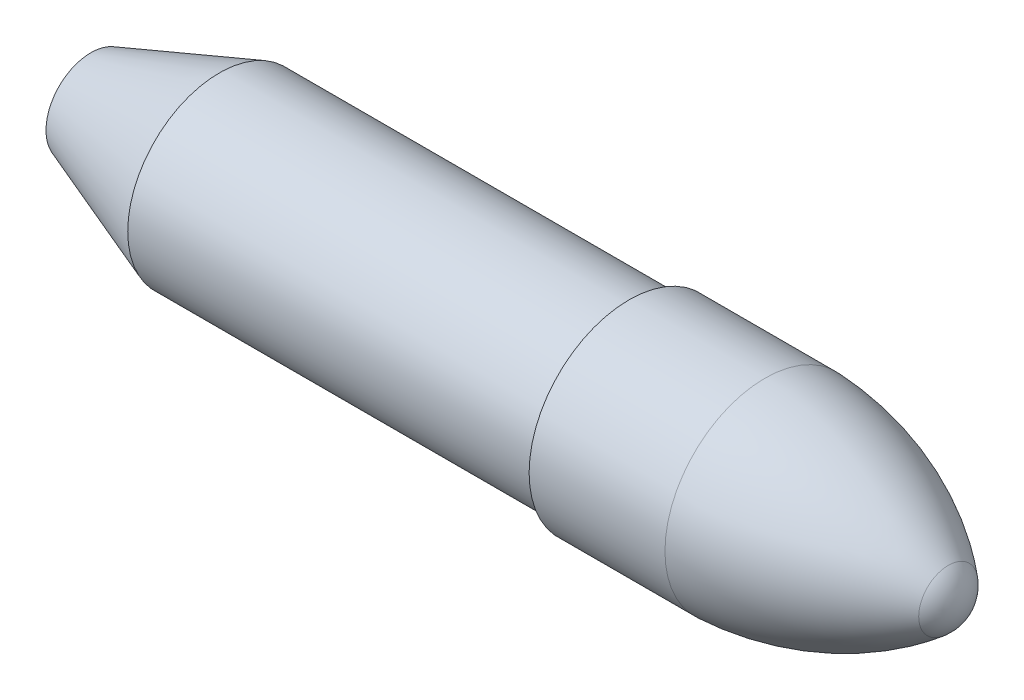
from build123d import *


with BuildPart() as part:
    # Esboço1 → Revolução1 (revolve)
    with BuildSketch(Plane.XY, mode=Mode.PRIVATE) as revolu_o1_sk:
        with BuildLine():
            Line((0, 0), (0, 1.75))
            Line((0, 1.75), (5.014146291, 3.575))
            Line((5.014146291, 3.575), (21, 3.575))
            Line((21, 3.575), (21, 3.9))
            Line((21, 3.9), (26.3, 3.9))
            ThreePointArc((26.3, 3.9), (30.103104016, 3.114541229), (33.456230179, 1.155691933))
            ThreePointArc((33.456230179, 1.155691933), (33.857266604, 0.638613628), (34, 0))
            Line((34, 0), (0, 0))
        make_face()
    revolve(revolu_o1_sk.sketch.rotate(Axis((0, 0, 0), (1, 0, 0)), 90), axis=Axis((0, 0, 0), (1, 0, 0)))


solid = part.part
